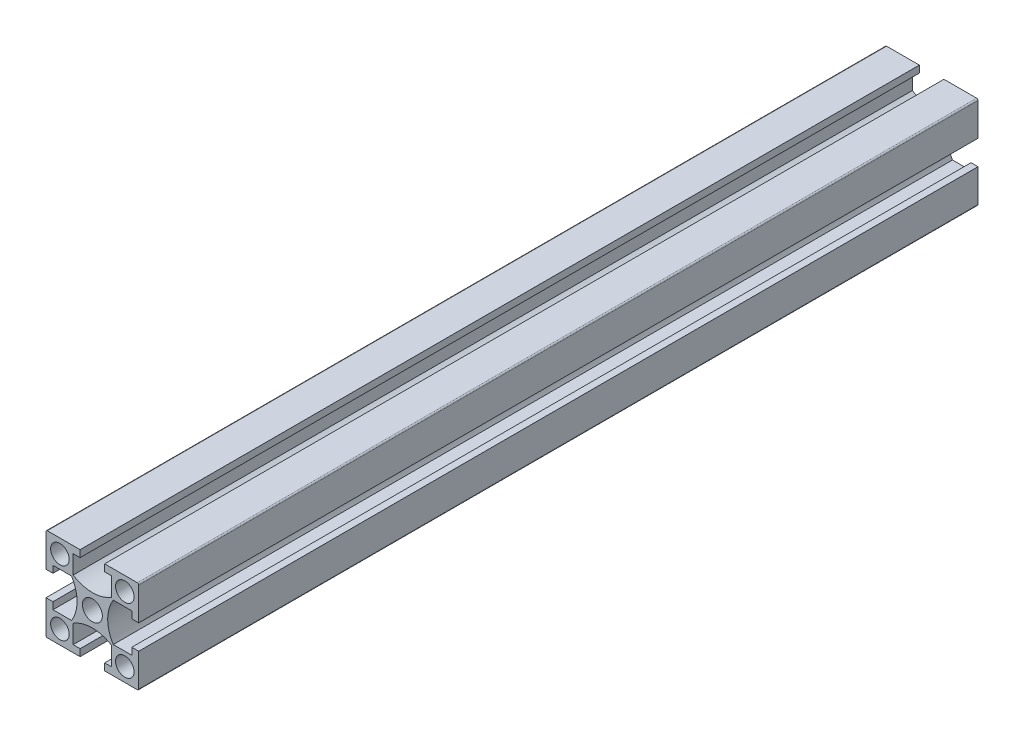
from build123d import *

# Parameters (mm, degrees)
SKETCH_1_W               = 20
SKETCH_1_H               = 20
SKETCH_1_R               = 2
SKETCH_1_R_2             = 2.15
EXTRUDE_1_DEPTH          = 181
CUT_EXTRUDE_1_REACH      = 183.552
PATTERN_CIRCULAR_1_COUNT = 4
FILLET_1_R               = 0.3
SKETCH_2_R               = 2.5
CUT_EXTRUDE_2_DEPTH      = 183.375985261


with BuildPart() as part:
    # 스케치1 → 보스-돌출1 (new body)
    with BuildSketch(Plane.XY):
        Rectangle(SKETCH_1_W, SKETCH_1_H)
        with Locations((-7, -7)):
            Circle(SKETCH_1_R, mode=Mode.SUBTRACT)
        with Locations((7, -7)):
            Circle(SKETCH_1_R, mode=Mode.SUBTRACT)
        with Locations((-7, 7)):
            Circle(SKETCH_1_R, mode=Mode.SUBTRACT)
        Circle(SKETCH_1_R_2, mode=Mode.SUBTRACT)
        with Locations((7, 7)):
            Circle(SKETCH_1_R, mode=Mode.SUBTRACT)
    extrude(amount=EXTRUDE_1_DEPTH)

    # 스케치1<3> → 컷-돌출1 (cut, up to next)
    with BuildSketch(Plane.XY, mode=Mode.PRIVATE) as cut_extrude_1_sk1:
        with BuildLine():
            Line((-8.5, 2.65), (-10, 2.65))
            Line((-10, 2.65), (-10, -2.65))
            Line((-10, -2.65), (-8.5, -2.65))
            Line((-8.5, -2.65), (-8.5, -4.15))
            Line((-8.5, -4.15), (-4.503166667, -4.15))
            ThreePointArc((-4.503166667, -4.15), (-3.3, 0), (-4.503166667, 4.15))
            Line((-4.503166667, 4.15), (-8.5, 4.15))
            Line((-8.5, 4.15), (-8.5, 2.65))
        make_face()
    cut_extrude_1_tool1 = extrude(cut_extrude_1_sk1.sketch, amount=CUT_EXTRUDE_1_REACH, mode=Mode.PRIVATE) & part.part
    cut_extrude_1 = cut_extrude_1_tool1.solids().sort_by_distance((-6.606913, 0, 0))[0]
    add(cut_extrude_1, mode=Mode.SUBTRACT)

    # 원형 패턴1: 컷-돌출1 ×4 about axis
    pattern_circular_1_axis = Axis((0, 0, 181), (0, 0, -1))
    for i in range(1, PATTERN_CIRCULAR_1_COUNT):
        add(cut_extrude_1.rotate(pattern_circular_1_axis, i * 360 / PATTERN_CIRCULAR_1_COUNT), mode=Mode.SUBTRACT)

    # 필렛1
    fillet_1_edges = [part.edges().sort_by_distance(p)[0] for p in [
        (10, -10, 90.5),
        (-10, -10, 90.5),
        (-10, 10, 90.5),
        (10, 10, 90.5),
    ]]
    fillet(fillet_1_edges, radius=FILLET_1_R)

    # 스케치2 → 컷-돌출2 (cut, through all)
    with BuildSketch(Plane.ZY.offset(10)):
        with Locations((11, 0)):
            Circle(SKETCH_2_R)
        with Locations((172, 0)):
            Circle(SKETCH_2_R)
    extrude(amount=-CUT_EXTRUDE_2_DEPTH, mode=Mode.SUBTRACT)


solid = part.part
